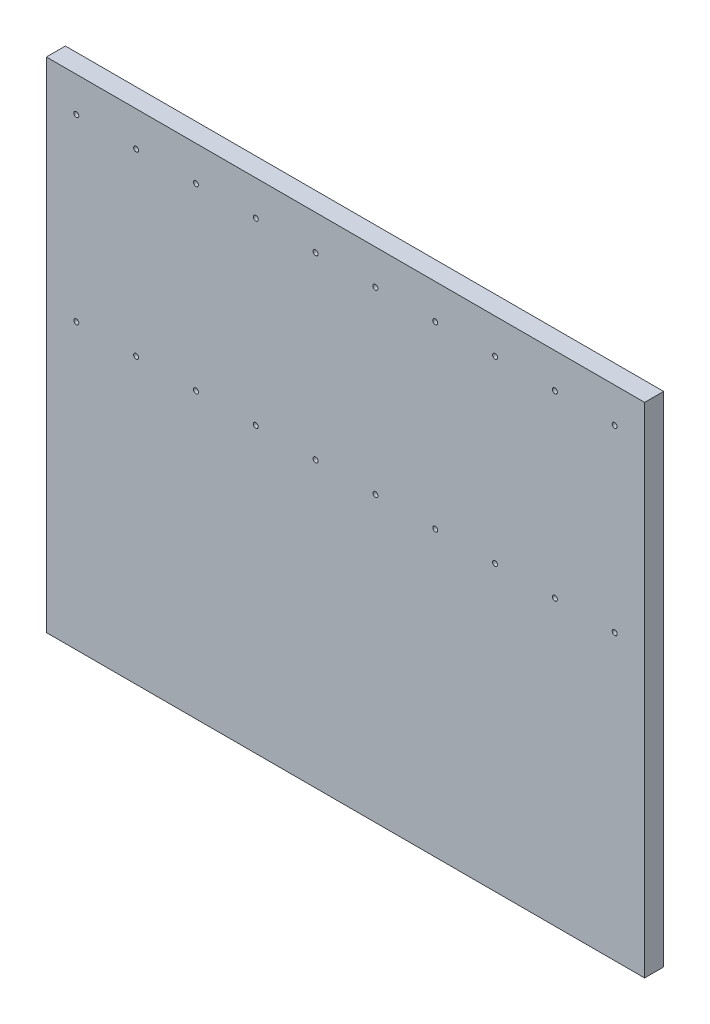
from build123d import *

# Parameters (mm, degrees)
BOSS_EXTRUDE1_DEPTH = 19.05
SKETCH2_R           = 2.5
CUT_EXTRUDE1_DEPTH  = 5


with BuildPart() as part:
    # Sketch1 → Boss-Extrude1 (new body)
    with BuildSketch(Plane.XY):
        Polygon((300, 185), (300, 250), (-300, 250), (-300, -250), (300, -250), align=None)
    extrude(amount=BOSS_EXTRUDE1_DEPTH)

    # Sketch2 → Cut-Extrude1 (cut)
    with BuildSketch(Plane.XY.offset(19.05)):
        with Locations((270, 35)):
            Circle(SKETCH2_R)
        with Locations((210, 35)):
            Circle(SKETCH2_R)
        with Locations((150, 35)):
            Circle(SKETCH2_R)
        with Locations((90, 35)):
            Circle(SKETCH2_R)
        with Locations((30, 35)):
            Circle(SKETCH2_R)
        with Locations((-30, 35)):
            Circle(SKETCH2_R)
        with Locations((-90, 35)):
            Circle(SKETCH2_R)
        with Locations((-150, 35)):
            Circle(SKETCH2_R)
        with Locations((-210, 35)):
            Circle(SKETCH2_R)
        with Locations((-270, 35)):
            Circle(SKETCH2_R)
        with Locations((-270, 215)):
            Circle(SKETCH2_R)
        with Locations((-210, 215)):
            Circle(SKETCH2_R)
        with Locations((-150, 215)):
            Circle(SKETCH2_R)
        with Locations((-90, 215)):
            Circle(SKETCH2_R)
        with Locations((-30, 215)):
            Circle(SKETCH2_R)
        with Locations((30, 215)):
            Circle(SKETCH2_R)
        with Locations((90, 215)):
            Circle(SKETCH2_R)
        with Locations((150, 215)):
            Circle(SKETCH2_R)
        with Locations((210, 215)):
            Circle(SKETCH2_R)
        with Locations((270, 215)):
            Circle(SKETCH2_R)
    extrude(amount=-CUT_EXTRUDE1_DEPTH, mode=Mode.SUBTRACT)


solid = part.part
